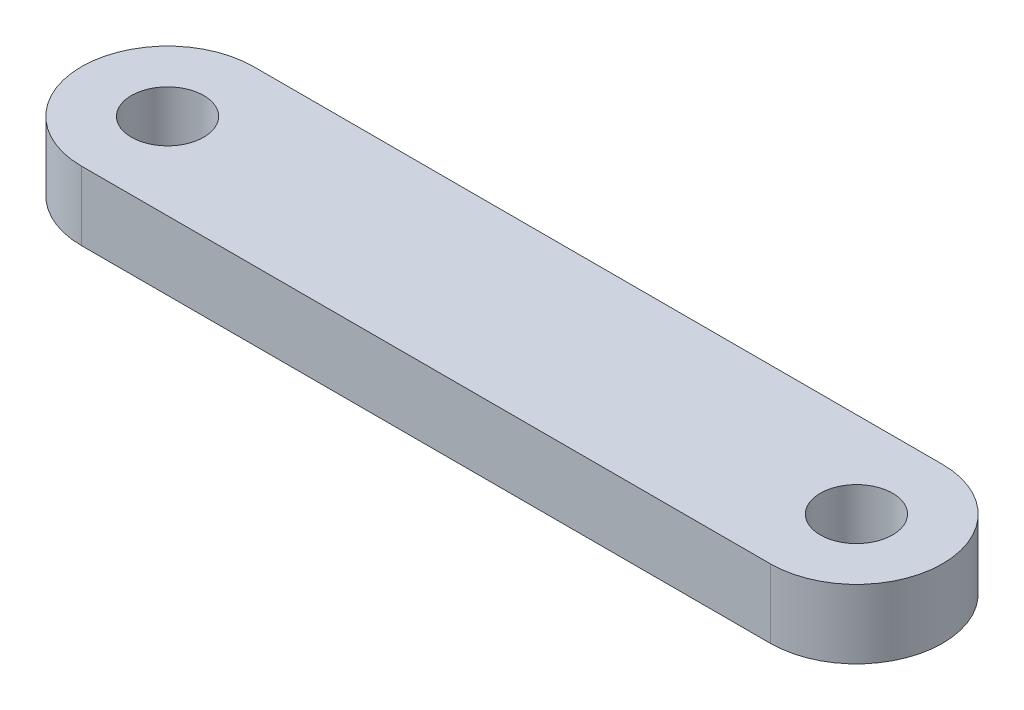
from build123d import *

# Parameters (mm, degrees)
SKETCH1_R           = 1.05
BOSS_EXTRUDE1_DEPTH = 2


with BuildPart() as part:
    # Sketch1 → Boss-Extrude1 (new body)
    with BuildSketch(Plane(origin=(0, 0, 0), x_dir=(1, 0, 0), z_dir=(0, 1, 0))):
        with BuildLine():
            Line((0, 2.5), (20, 2.5))
            ThreePointArc((20, 2.5), (22.5, 0), (20, -2.5))
            Line((20, -2.5), (0, -2.5))
            ThreePointArc((0, -2.5), (-2.5, 0), (0, 2.5))
        make_face()
        with Locations(Location((0, 0, 0), (0, 0, 270))):
            Circle(SKETCH1_R, mode=Mode.SUBTRACT)
        with Locations(Location((20, 0, 0), (0, 0, 270))):
            Circle(SKETCH1_R, mode=Mode.SUBTRACT)
    extrude(amount=BOSS_EXTRUDE1_DEPTH)


solid = part.part
